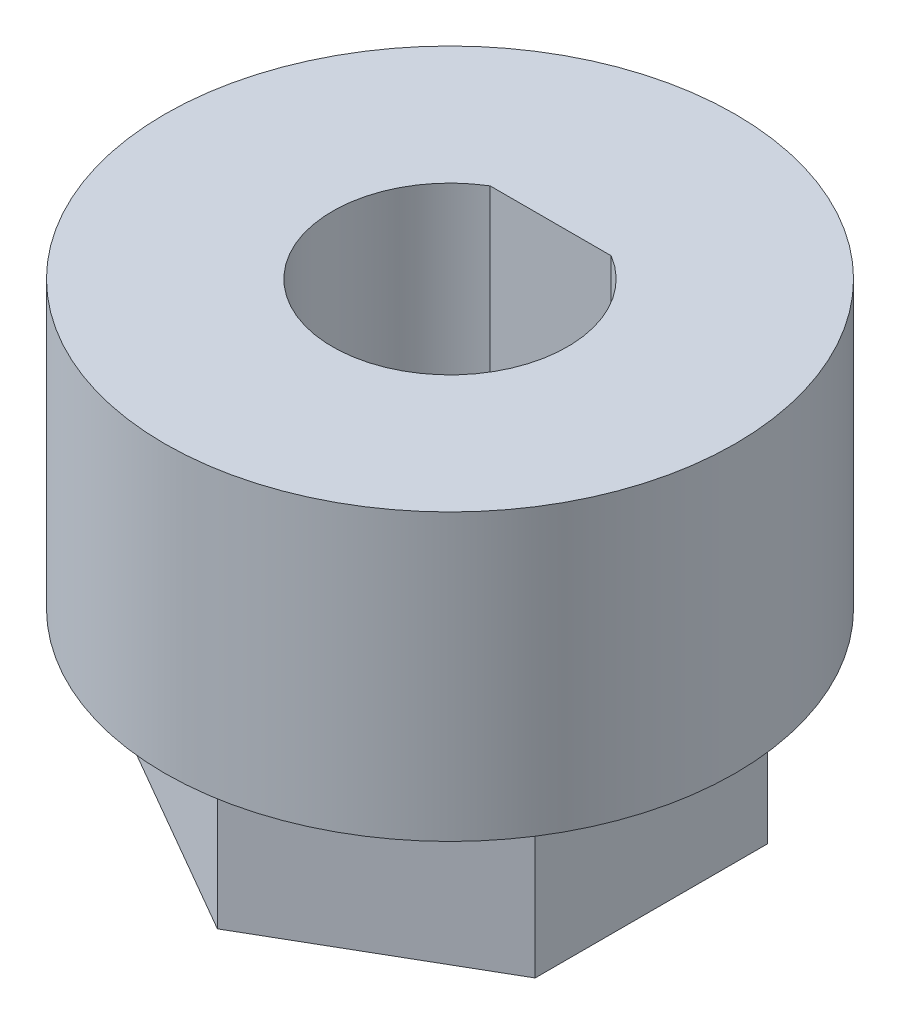
from build123d import *

# Parameters (mm, degrees)
BOSS_EXTRUDE1_DEPTH = 4.8
SKETCH2_R           = 8.5
BOSS_EXTRUDE2_DEPTH = 8.5
CUT_EXTRUDE1_DEPTH  = 18.927353402


with BuildPart() as part:
    # Sketch1 → Boss-Extrude1 (new body)
    with BuildSketch(Plane(origin=(0, 0, 0), x_dir=(1, 0, 0), z_dir=(0, 1, 0))):
        Polygon((-6, 3.464101615), (0, 6.92820323), (6, 3.464101615), (6, -3.464101615), (0, -6.92820323), (-6, -3.464101615), align=None)
    extrude(amount=BOSS_EXTRUDE1_DEPTH)

    # Sketch2 → Boss-Extrude2 (add)
    with BuildSketch(Plane(origin=(0, 4.8, 0), x_dir=(1, 0, 0), z_dir=(0, 1, 0))):
        with Locations(Location((0, 0, 0), (0, 0, 270))):
            Circle(SKETCH2_R)
    extrude(amount=BOSS_EXTRUDE2_DEPTH)

    # Sketch3 → Cut-Extrude1 (cut, through all)
    with BuildSketch(Plane(origin=(0, 13.3, 0), x_dir=(1, 0, 0), z_dir=(0, 1, 0))):
        with BuildLine():
            Line((-1.802775638, 3), (1.802775638, 3))
            ThreePointArc((1.802775638, 3), (0, -3.5), (-1.802775638, 3))
        make_face()
    extrude(amount=-CUT_EXTRUDE1_DEPTH, mode=Mode.SUBTRACT)


solid = part.part
